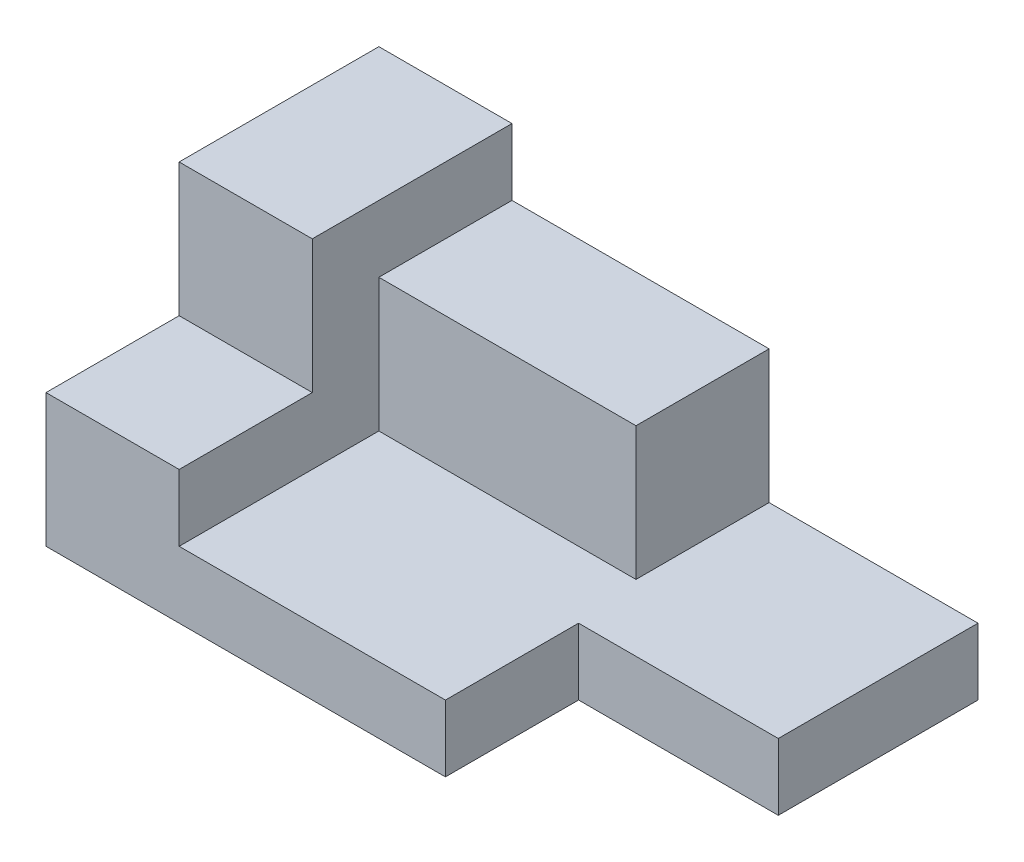
from build123d import *

# Parameters (mm, degrees)
BOSS_EXTRUDE2_DEPTH = 10
SKETCH2_W           = 20
SKETCH2_H           = 20
BOSS_EXTRUDE3_DEPTH = 10
SKETCH3_W           = 40
SKETCH3_H           = 20
BOSS_EXTRUDE4_DEPTH = 20
SKETCH4_W           = 20
SKETCH4_H           = 30
BOSS_EXTRUDE6_DEPTH = 30


with BuildPart() as part:
    # Sketch1 → Boss-Extrude2 (new body)
    with BuildSketch(Plane(origin=(0, 0, 0), x_dir=(1, 0, 0), z_dir=(0, 1, 0))):
        Polygon((0, 0), (60, 0), (60, 20), (90, 20), (90, 50), (60, 50), (0, 50), align=None)
    extrude(amount=BOSS_EXTRUDE2_DEPTH)

    # Sketch2 → Boss-Extrude3 (add)
    with BuildSketch(Plane(origin=(0, 10, 0), x_dir=(1, 0, 0), z_dir=(0, 1, 0))):
        with Locations((10, 10)):
            Rectangle(SKETCH2_W, SKETCH2_H)
    extrude(amount=BOSS_EXTRUDE3_DEPTH)

    # Sketch3 → Boss-Extrude4 (add)
    with BuildSketch(Plane(origin=(0, 10, 0), x_dir=(1, 0, 0), z_dir=(0, 1, 0))):
        with Locations((38.622423296, 40)):
            Rectangle(SKETCH3_W, SKETCH3_H)
    extrude(amount=BOSS_EXTRUDE4_DEPTH)

    # Sketch4 → Boss-Extrude6 (add)
    with BuildSketch(Plane(origin=(0, 10, 0), x_dir=(1, 0, 0), z_dir=(0, 1, 0))):
        with Locations((10, 35)):
            Rectangle(SKETCH4_W, SKETCH4_H)
    extrude(amount=BOSS_EXTRUDE6_DEPTH)


solid = part.part
